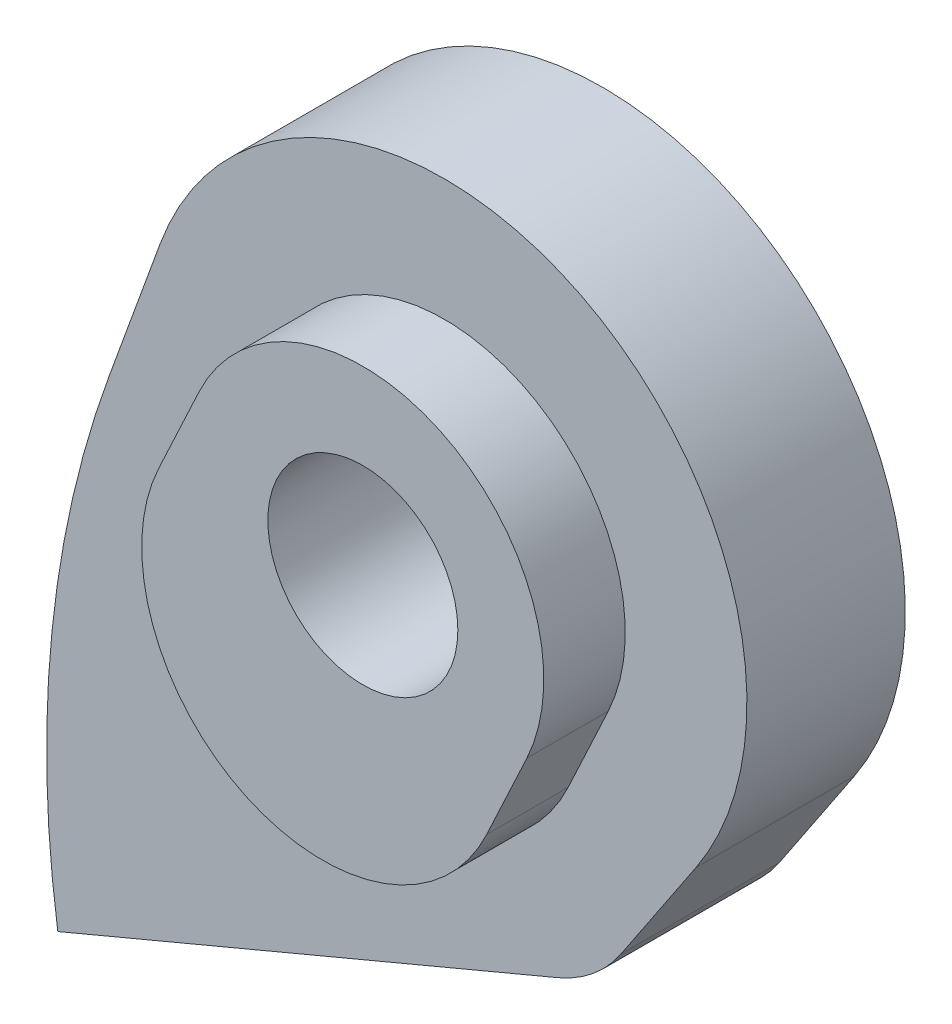
from build123d import *
from build123d.topology import SkipClean

# Parameters (mm, degrees)
SKETCH3_R           = 2.75
SKETCH3_R_2         = 2.1
BOSS_EXTRUDE2_DEPTH = 11
BOSS_EXTRUDE4_START = 3.5
BOSS_EXTRUDE4_DEPTH = 3.5
BOSS_EXTRUDE3_START = 3
BOSS_EXTRUDE3_DEPTH = 3
SKETCH14_W          = 47.285712055
SKETCH14_H          = 12.595473758
CUT_EXTRUDE1_DEPTH  = 92.326119258
BOSS_EXTRUDE5_DEPTH = 1.8
SKETCH15_R          = 2.1
CUT_EXTRUDE2_DEPTH  = 88.648676566


with BuildPart() as part:
    # Sketch3 → Boss-Extrude2 (new body)
    with BuildSketch(Plane.XY):
        with BuildLine():
            Line((11.81639044, 60.252883085), (11.728372068, 60.311638564))
            ThreePointArc((11.728372068, 60.311638564), (8.917204522, 62.7925154), (6.866230988, 65.931132995))
            ThreePointArc((6.866230988, 65.931132995), (6.025591445, 67.274340702), (4.901176311, 68.390840765))
            ThreePointArc((4.901176311, 68.390840765), (3.375934297, 70.989881123), (4.020351516, 73.93370524))
            Line((4.020351516, 73.93370524), (5.678869184, 76.41823992))
            ThreePointArc((5.678869184, 76.41823992), (3.137547336, 86.100651278), (-6.171856019, 82.420649156))
            Line((-6.171856019, 82.420649156), (-7.290261888, 79.347854286))
            ThreePointArc((-7.290261888, 79.347854286), (-8.557893098, 69.185727028), (-5.279809822, 59.483671095))
            ThreePointArc((-5.279809822, 59.483671095), (-2.848156457, 57.139360441), (0.414833066, 56.266646336))
            ThreePointArc((0.414833066, 56.266646336), (3.287818882, 55.822166382), (5.91364728, 54.574514525))
            Line((5.91364728, 54.574514525), (7.374782695, 53.599153256))
            ThreePointArc((7.374782695, 53.599153256), (10.815902262, 50.678650143), (13.499590609, 47.049812979))
            ThreePointArc((13.499590609, 47.049812979), (24.965953819, 46.665736496), (20.21385057, 57.108078892))
            ThreePointArc((20.21385057, 57.108078892), (15.833272198, 58.194897845), (11.81639044, 60.252883085))
        make_face()
        with Locations((19.351869275, 50.413343031)):
            Circle(SKETCH3_R, mode=Mode.SUBTRACT)
        with Locations((0.471910886, 63.016405008)):
            Circle(SKETCH3_R, mode=Mode.SUBTRACT)
        with Locations((0.114687614, 80.132534397)):
            Circle(SKETCH3_R_2, mode=Mode.SUBTRACT)
    extrude(amount=BOSS_EXTRUDE2_DEPTH)

    # Sketch13 → Boss-Extrude4 (add)
    with SkipClean():  # the faces are left unmerged after this step: merging them gives an invalid solid
        with BuildSketch(Plane(origin=(0, 0, 0), x_dir=(-1, 0, 0), z_dir=(0, 0, -1)).offset(BOSS_EXTRUDE4_START)):
            with BuildLine():
                Line((-5.678869184, 76.41823992), (-4.020351516, 73.93370524))
                ThreePointArc((-4.020351516, 73.93370524), (-3.407782277, 73.255690271), (-2.625844204, 72.782913134))
                Line((-2.625844204, 72.782913134), (8.427696777, 68.139691908))
                ThreePointArc((8.427696777, 68.139691908), (8.557268078, 73.814637343), (7.290261888, 79.347854286))
                Line((7.290261888, 79.347854286), (6.171856019, 82.420649156))
                ThreePointArc((6.171856019, 82.420649156), (-3.137547336, 86.100651278), (-5.678869184, 76.41823992))
            make_face()
        extrude(amount=-BOSS_EXTRUDE4_DEPTH)

    # Sketch12 → Boss-Extrude3 (add)
    with SkipClean():  # the faces are left unmerged after this step: merging them gives an invalid solid
        with BuildSketch(Plane(origin=(0, 0, -3.5), x_dir=(-1, 0, 0), z_dir=(0, 0, -1)).offset(BOSS_EXTRUDE3_START)):
            with BuildLine():
                Line((8.013597957, 76.965805827), (4.924247842, 69.611373108))
                Line((4.924247842, 69.611373108), (8.427696777, 68.139691908))
                ThreePointArc((8.427696777, 68.139691908), (8.649339764, 72.572862025), (8.013597957, 76.965805827))
            make_face()
        extrude(amount=-BOSS_EXTRUDE3_DEPTH)

    # Sketch14 → Cut-Extrude1 (cut, through all)
    with BuildSketch(Plane(origin=(0, 0, 0), x_dir=(1, 0, 0), z_dir=(0, 1, 0))):
        with Locations((8.412006537, -6.297736879)):
            Rectangle(SKETCH14_W, SKETCH14_H)
    extrude(amount=CUT_EXTRUDE1_DEPTH, mode=Mode.SUBTRACT)

    # Sketch16 → Boss-Extrude5 (add)
    with BuildSketch(Plane.XY):
        with BuildLine():
            Line((3.739918762, 78.44206135), (2.852420412, 76.538814997))
            ThreePointArc((2.852420412, 76.538814997), (-2.463283783, 74.604056896), (-4.398041884, 79.919761091))
            Line((-4.398041884, 79.919761091), (-3.510543534, 81.823007444))
            ThreePointArc((-3.510543534, 81.823007444), (1.805160661, 83.757765545), (3.739918762, 78.44206135))
        make_face()
    extrude(amount=BOSS_EXTRUDE5_DEPTH)

    # Sketch15 → Cut-Extrude2 (cut, through all)
    with BuildSketch(Plane.XY.offset(1.8)):
        with Locations((0.114687614, 80.132534397)):
            Circle(SKETCH15_R)
    extrude(amount=-CUT_EXTRUDE2_DEPTH, mode=Mode.SUBTRACT)


solid = part.part
